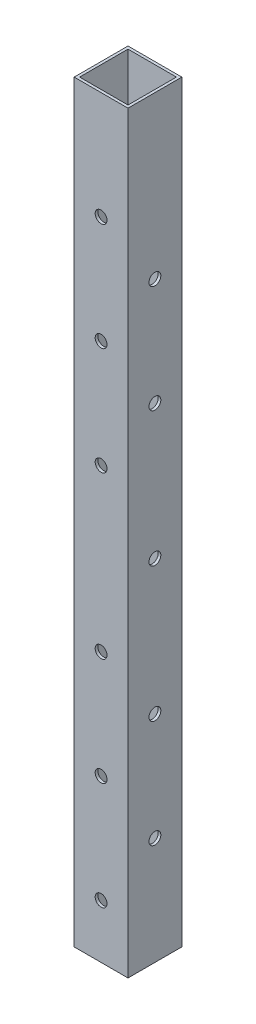
from build123d import *

# Parameters (mm, degrees)
EXTRUDE_1_DEPTH     = 280
SKETCH_2_R          = 2.2
CUT_EXTRUDE_1_DEPTH = 280
SKETCH_3_R          = 2.2
CUT_EXTRUDE_2_DEPTH = 20


with BuildPart() as part:
    # 草图1 → 凸台-拉伸1 (new body)
    with BuildSketch(Plane(origin=(0, 0, 0), x_dir=(1, 0, 0), z_dir=(0, 1, 0))):
        Polygon((10, 0), (10, 10), (0, 10), (-10, 10), (-10, 0), (-10, -10), (0, -10), (10, -10), align=None)
        Polygon((9, 0), (9, 9), (0, 9), (-9, 9), (-9, 0), (-9, -9), (0, -9), (9, -9), align=None, mode=Mode.SUBTRACT)
    extrude(amount=-EXTRUDE_1_DEPTH)

    # 草图2 → 切除-拉伸1 (cut)
    with BuildSketch(Plane.XY.offset(10)):
        with Locations(Location((0, -40, 0), (0, 0, 180))):
            Circle(SKETCH_2_R)
        with Locations(Location((0, -80, 0), (0, 0, 180))):
            Circle(SKETCH_2_R)
        with Locations(Location((0, -120, 0), (0, 0, 180))):
            Circle(SKETCH_2_R)
        with Locations(Location((0, -180, 0), (0, 0, 180))):
            Circle(SKETCH_2_R)
        with Locations(Location((0, -220, 0), (0, 0, 180))):
            Circle(SKETCH_2_R)
        with Locations(Location((0, -260, 0), (0, 0, 180))):
            Circle(SKETCH_2_R)
    extrude(amount=-CUT_EXTRUDE_1_DEPTH, mode=Mode.SUBTRACT)

    # 草图3 → 切除-拉伸2 (cut)
    with BuildSketch(Plane(origin=(10, 0, 0), x_dir=(0, 0, -1), z_dir=(1, 0, 0))):
        with Locations((0, -60)):
            Circle(SKETCH_3_R)
        with Locations((0, -100)):
            Circle(SKETCH_3_R)
        with Locations((0, -150)):
            Circle(SKETCH_3_R)
        with Locations((0, -200)):
            Circle(SKETCH_3_R)
        with Locations((0, -240)):
            Circle(SKETCH_3_R)
    extrude(amount=-CUT_EXTRUDE_2_DEPTH, mode=Mode.SUBTRACT)


solid = part.part
